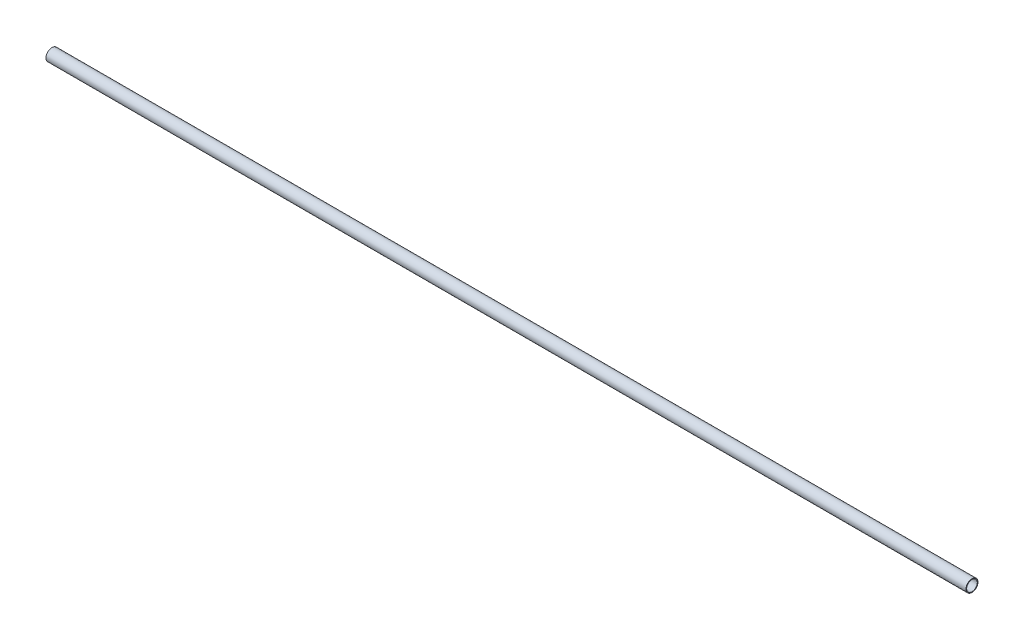
from build123d import *

# Parameters (mm, degrees)
SKETCH2_R   = 8.9662
SKETCH2_R_2 = 7.8994


with BuildPart() as part:
    # Sweep1: sweep along a path in Sketch1
    with BuildLine(Plane(origin=(0, 0, 0), x_dir=(1, 0, 0), z_dir=(0, 1, 0))) as sweep1_path:
        Line((0, 0), (1371.6, 0))
    # Sketch2 → Sweep1 (sweep)
    with BuildSketch(Plane(origin=(0, 0, 0), x_dir=(0, 0, -1), z_dir=(1, 0, 0))):
        Circle(SKETCH2_R)
        Circle(SKETCH2_R_2, mode=Mode.SUBTRACT)
    sweep(path=sweep1_path.line)


solid = part.part
